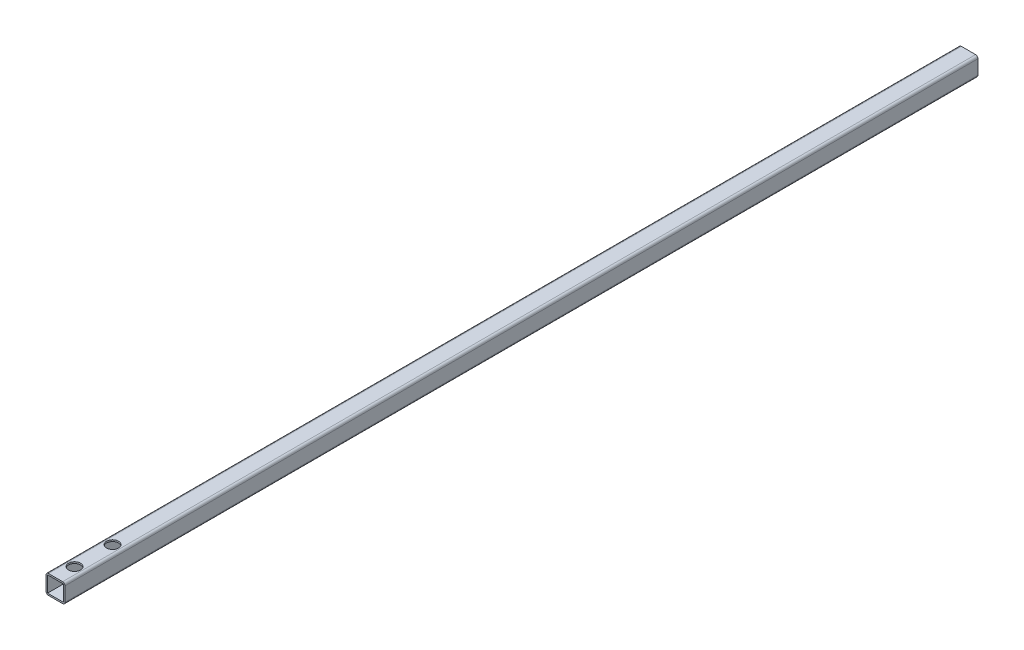
from build123d import *

# Parameters (mm, degrees)
SKETCH1_W           = 21.1836
SKETCH1_H           = 21.1836
BOSS_EXTRUDE1_DEPTH = 1219.2
SKETCH2_R           = 8.001
CUT_EXTRUDE1_DEPTH  = 1219.2


with BuildPart() as part:
    # Sketch1 → Boss-Extrude1 (new body)
    with BuildSketch(Plane.XY):
        with BuildLine():
            Line((-9.525, -12.7), (9.525, -12.7))
            ThreePointArc((9.525, -12.7), (11.77006403, -11.77006403), (12.7, -9.525))
            Line((12.7, -9.525), (12.7, 9.525))
            ThreePointArc((12.7, 9.525), (11.77006403, 11.77006403), (9.525, 12.7))
            Line((9.525, 12.7), (-9.525, 12.7))
            ThreePointArc((-9.525, 12.7), (-11.77006403, 11.77006403), (-12.7, 9.525))
            Line((-12.7, 9.525), (-12.7, -9.525))
            ThreePointArc((-12.7, -9.525), (-11.77006403, -11.77006403), (-9.525, -12.7))
        make_face()
        Rectangle(SKETCH1_W, SKETCH1_H, mode=Mode.SUBTRACT)
    extrude(amount=BOSS_EXTRUDE1_DEPTH)

    # Sketch2 → Cut-Extrude1 (cut)
    with BuildSketch(Plane(origin=(0, 12.7, 0), x_dir=(1, 0, 0), z_dir=(0, 1, 0))):
        with Locations(Location((0, -1193.8, 0), (0, 0, 270))):
            Circle(SKETCH2_R)
        with Locations(Location((0, -1143, 0), (0, 0, 270))):
            Circle(SKETCH2_R)
    extrude(amount=-CUT_EXTRUDE1_DEPTH, mode=Mode.SUBTRACT)


solid = part.part
